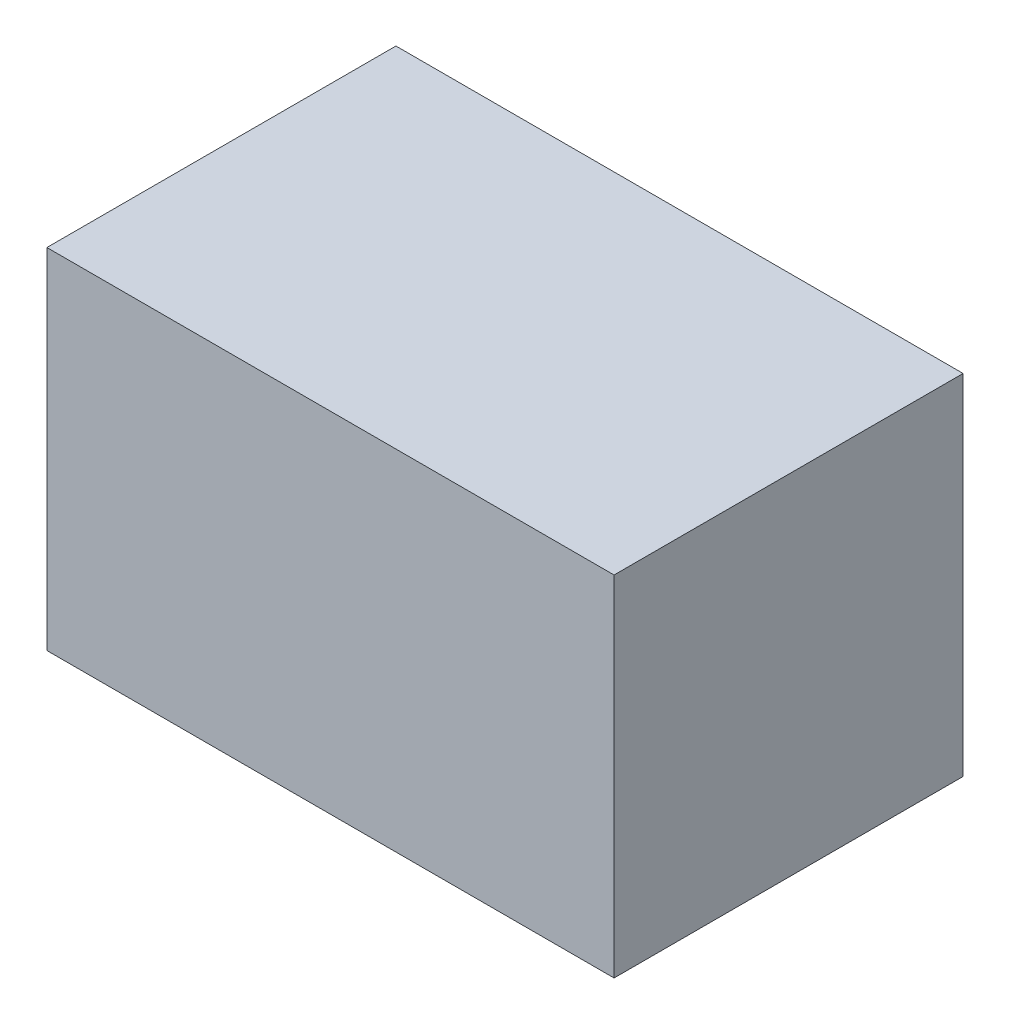
from build123d import *

# Parameters (mm, degrees)
SKETCH1_W           = 330.2
SKETCH1_H           = 203.2
BOSS_EXTRUDE1_DEPTH = 203.2


with BuildPart() as part:
    # Sketch1 → Boss-Extrude1 (new body)
    with BuildSketch(Plane(origin=(0, 0, 0), x_dir=(1, 0, 0), z_dir=(0, 1, 0))):
        Rectangle(SKETCH1_W, SKETCH1_H)
    extrude(amount=BOSS_EXTRUDE1_DEPTH)


solid = part.part
